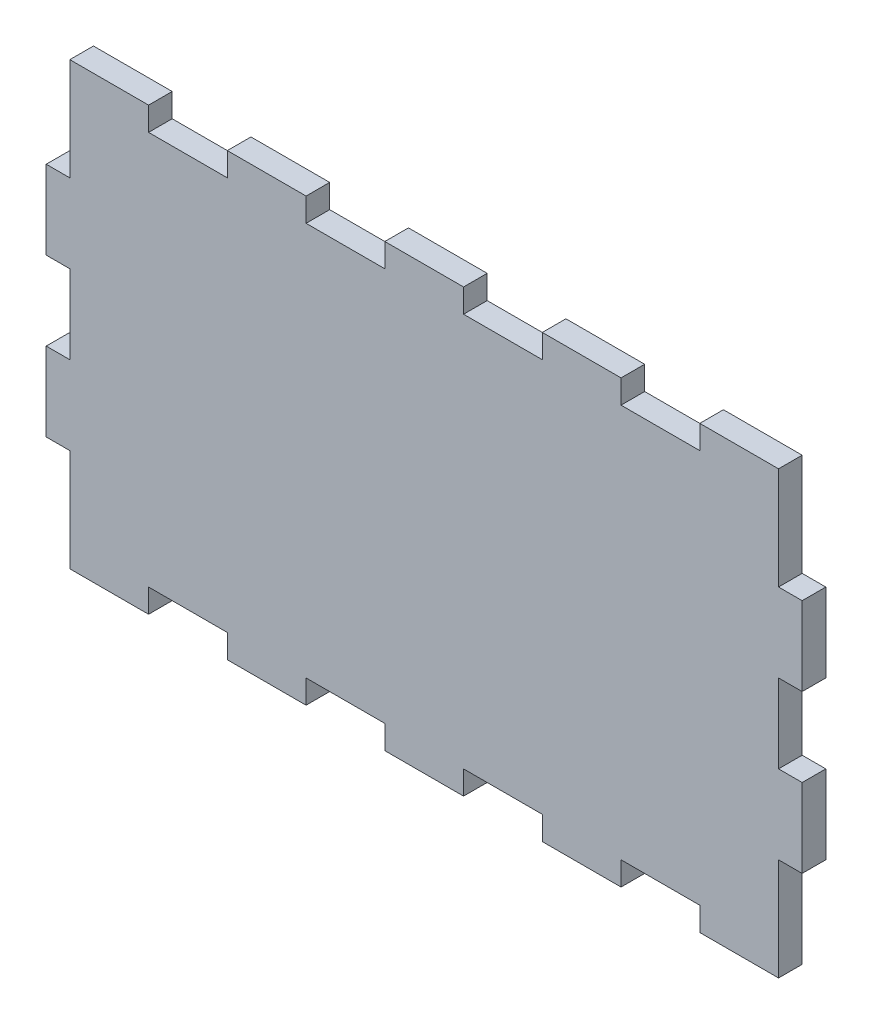
from build123d import *

# Parameters (mm, degrees)
BOSS_EXTRUDE1_DEPTH = 3


with BuildPart() as part:
    # Sketch1 → Boss-Extrude1 (new body)
    with BuildSketch(Plane.XY):
        Polygon((25, 28), (25, 25), (35, 25), (35, 28), (45, 28), (45, 25), (45, 15), (48, 15), (48, 5), (45, 5), (45, -5), (48, -5), (48, -15), (45, -15), (45, -25), (45, -28), (35, -28), (35, -25), (25, -25), (25, -28), (15, -28), (15, -25), (5, -25), (5, -28), (-5, -28), (-5, -25), (-15, -25), (-15, -28), (-25, -28), (-25, -25), (-35, -25), (-35, -28), (-45, -28), (-45, -25), (-45, -15), (-48, -15), (-48, -5), (-45, -5), (-45, 5), (-48, 5), (-48, 15), (-45, 15), (-45, 25), (-45, 28), (-35, 28), (-35, 25), (-25, 25), (-25, 28), (-15, 28), (-15, 25), (-5, 25), (-5, 28), (5, 28), (5, 25), (15, 25), (15, 28), align=None)
    extrude(amount=BOSS_EXTRUDE1_DEPTH)


solid = part.part
